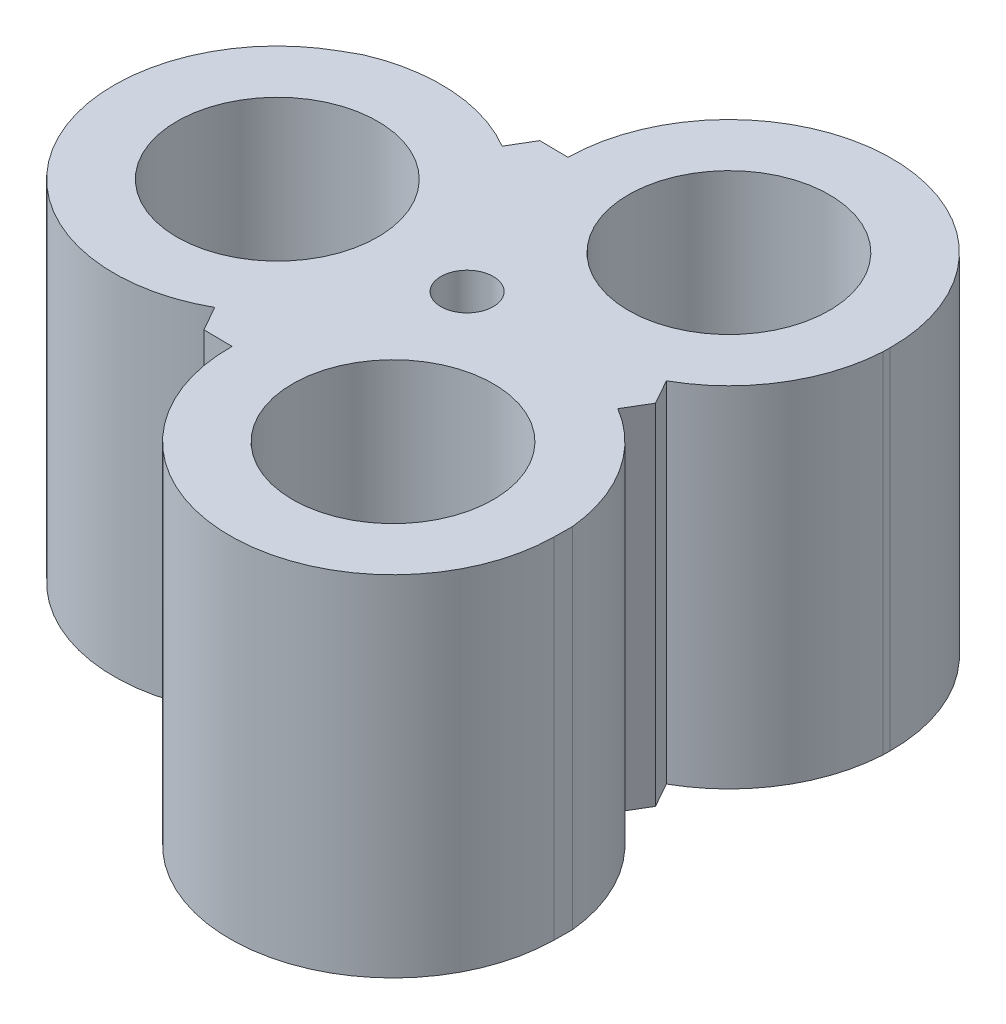
from build123d import *

# Parameters (mm, degrees)
SKETCH5_R               = 30
BOSS_EXTRUDE1_DEPTH     = 20
SKETCH6_R               = 5.75
CUT_EXTRUDE1_DEPTH      = 50
CUT_EXTRUDE_THIN1_DEPTH = 50
SKETCH11_R              = 1.5
CUT_EXTRUDE2_DEPTH      = 35.227641189


with BuildPart() as part:
    # Sketch5 → Boss-Extrude1 (new body)
    with BuildSketch(Plane(origin=(0, 0, 0), x_dir=(1, 0, 0), z_dir=(0, 1, 0))):
        with Locations(Location((0, 0, 0), (0, 0, 270))):
            Circle(SKETCH5_R)
    extrude(amount=BOSS_EXTRUDE1_DEPTH)

    # Sketch6 → Cut-Extrude1 (cut)
    with BuildSketch(Plane(origin=(0, 20, 0), x_dir=(1, 0, 0), z_dir=(0, 1, 0))):
        with Locations(Location((5.564652455, 9.430649132, 0), (0, 0, 270))):
            Circle(SKETCH6_R)
        with Locations(Location((5.325305202, -9.567843252, 0), (0, 0, 270))):
            Circle(SKETCH6_R)
        with Locations(Location((-11.00819821, 0.138683741, 0), (0, 0, 270))):
            Circle(SKETCH6_R)
    extrude(amount=-CUT_EXTRUDE1_DEPTH, mode=Mode.SUBTRACT)

    # Sketch9 → Cut-Extrude-Thin1 (cut)
    with BuildSketch(Plane(origin=(0, 20, 0), x_dir=(1, 0, 0), z_dir=(0, 1, 0))):
        with BuildLine():
            ThreePointArc((-3.76991423, 9.548248089), (5.682251411, 18.765215817), (14.899219139, 9.313050176))
            Line((14.899219139, 9.313050176), (14.659871887, -9.685442209))
            ThreePointArc((14.659871887, -9.685442209), (5.207706246, -18.902409937), (-4.009261482, -9.450244295))
            Line((-4.009261482, -9.450244295), (-14.008468, -9.324272058))
            ThreePointArc((-14.008468, -9.324272058), (5.081734008, -28.901616455), (24.659078405, -9.811414447))
            Line((24.659078405, -9.811414447), (24.898425657, 9.187077938))
            ThreePointArc((24.898425657, 9.187077938), (5.808223649, 28.764422335), (-13.769120748, 9.674220327))
            Line((-13.769120748, 9.674220327), (-3.76991423, 9.548248089))
        make_face()
        with BuildLine():
            ThreePointArc((10.124185438, -1.49260411), (13.400544345, -14.366723488), (0.526424967, -17.643082394))
            Line((0.526424967, -17.643082394), (-15.807078446, -7.936555401))
            ThreePointArc((-15.807078446, -7.936555401), (-19.083437352, 4.937563977), (-6.209317974, 8.213922883))
            Line((-6.209317974, 8.213922883), (-1.100619557, 16.810503626))
            ThreePointArc((-1.100619557, 16.810503626), (-27.680018096, 10.046262394), (-20.915776863, -16.533136145))
            Line((-20.915776863, -16.533136145), (-4.582273451, -26.239663138))
            ThreePointArc((-4.582273451, -26.239663138), (21.997125088, -19.475421905), (15.232883856, 7.103976633))
            Line((15.232883856, 7.103976633), (10.124185438, -1.49260411))
        make_face()
        with BuildLine():
            ThreePointArc((-6.438623457, -8.011462842), (-19.158344793, -4.430891012), (-15.577772963, 8.288830324))
            Line((-15.577772963, 8.288830324), (0.995077701, 17.580795716))
            ThreePointArc((0.995077701, 17.580795716), (13.714799038, 14.000223886), (10.134227208, 1.280502549))
            Line((10.134227208, 1.280502549), (15.024735309, -7.442050432))
            ThreePointArc((15.024735309, -7.442050432), (22.437352019, 18.890731987), (-3.8954304, 26.303348697))
            Line((-3.8954304, 26.303348697), (-20.468281064, 17.011383305))
            ThreePointArc((-20.468281064, 17.011383305), (-27.880897775, -9.321399113), (-1.548115356, -16.734015824))
            Line((-1.548115356, -16.734015824), (-6.438623457, -8.011462842))
        make_face()
    extrude(amount=-CUT_EXTRUDE_THIN1_DEPTH, mode=Mode.SUBTRACT)


with BuildPart() as cut_extrude_thin1_kept_piece:
    # of the separate pieces the step leaves, the one the design keeps (cut_extrude_thin1_pieces_kept)
    add(part.part.solids().sort_by_distance((-4.009261482, 0, 9.450244295))[0])

    # Sketch11 → Cut-Extrude2 (cut, through all)
    with BuildSketch(Plane(origin=(0, 20, 0), x_dir=(1, 0, 0), z_dir=(0, 1, 0))):
        with Locations(Location((0, 0, 0), (0, 0, 270))):
            Circle(SKETCH11_R)
    extrude(amount=-CUT_EXTRUDE2_DEPTH, mode=Mode.SUBTRACT)


solid = cut_extrude_thin1_kept_piece.part
